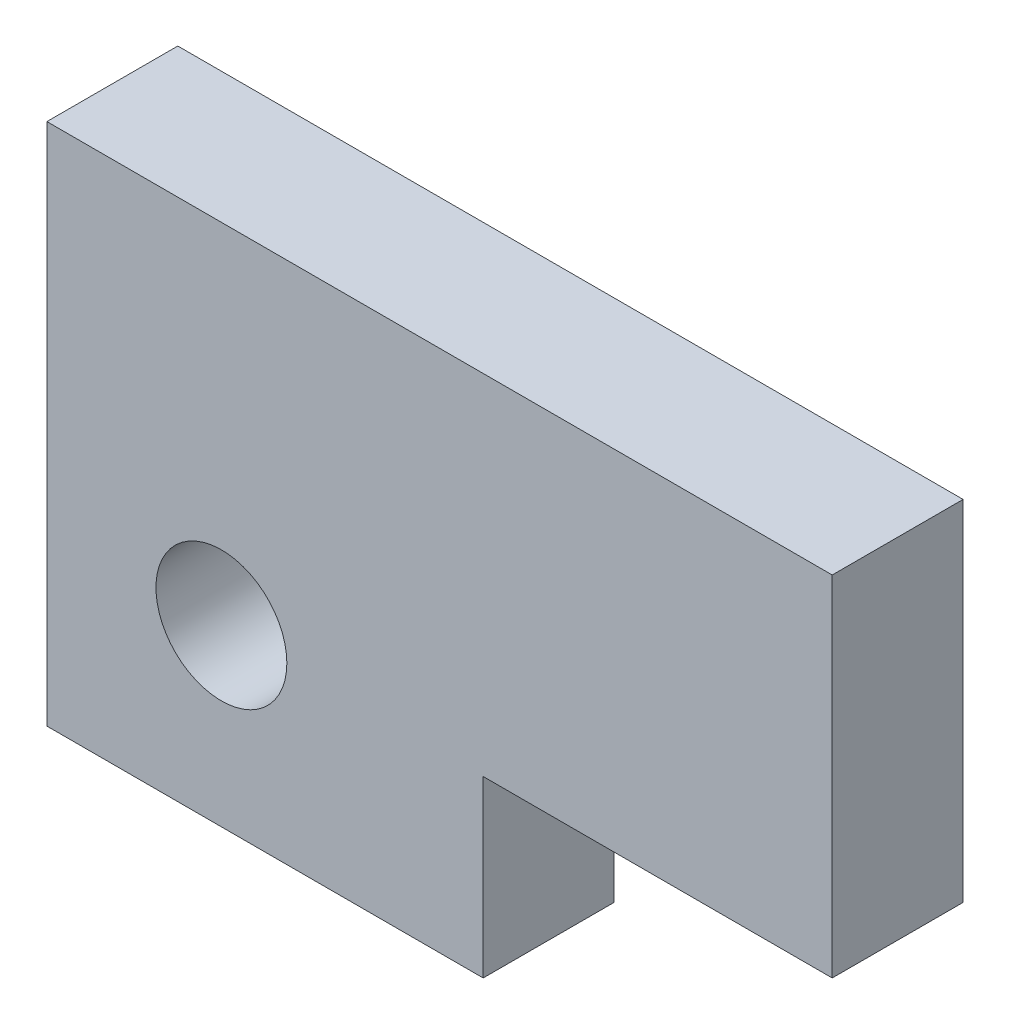
from build123d import *

# Parameters (mm, degrees)
EXTRUDE_1_DEPTH     = 3
SKETCH_2_R          = 1.5
CUT_EXTRUDE_1_DEPTH = 22.840329668


with BuildPart() as part:
    # Эскиз1 → Бобышка-Вытянуть1 (new body)
    with BuildSketch(Plane.XY):
        Polygon((0, 0), (10, 0), (10, 4), (18, 4), (18, 12), (0, 12), align=None)
    extrude(amount=EXTRUDE_1_DEPTH)

    # Эскиз2 → Вырез-Вытянуть1 (cut, through all)
    with BuildSketch(Plane.XY.offset(3)):
        with Locations((4, 4)):
            Circle(SKETCH_2_R)
    extrude(amount=-CUT_EXTRUDE_1_DEPTH, mode=Mode.SUBTRACT)


solid = part.part
